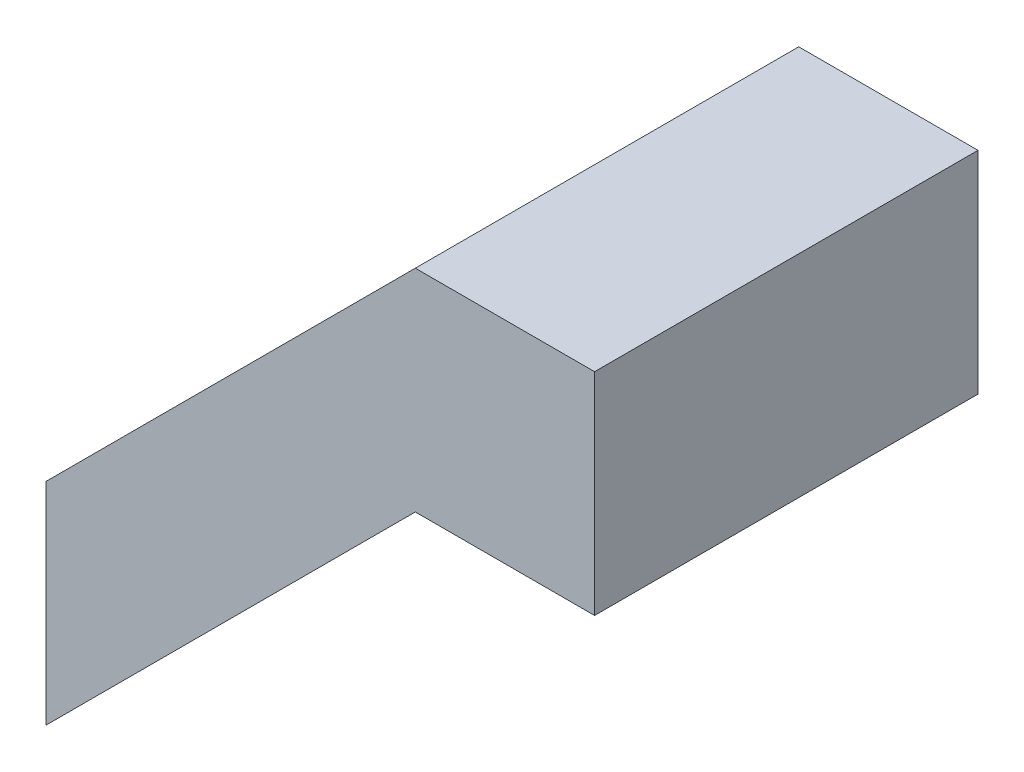
from build123d import *

# Parameters (mm, degrees)
SALIENTE_EXTRUIR1_DEPTH = 9.08
SALIENTE_EXTRUIR4_DEPTH = 1.5
SALIENTE_EXTRUIR5_DEPTH = 4.08


with BuildPart() as part:
    # Croquis1 → Saliente-Extruir1 (new body)
    with BuildSketch(Plane.XY):
        Polygon((126.24514053, -55.999935), (126.24514053, -50.999935), (121.99984, -50.999935), (113.25453947, -59.74523553), (113.25453947, -64.74523553), (115.25453947, -62.74523553), (115.25453947, -60.24523553), (119.25453947, -56.24523553), (119.25453947, -58.74523553), (121.99984, -55.999935), align=None)
    extrude(amount=-SALIENTE_EXTRUIR1_DEPTH)

    # Croquis4 → Saliente-Extruir4 (add)
    with BuildSketch(Plane.XY):
        Polygon((115.25453947, -60.24523553), (115.25453947, -62.74523553), (119.25453947, -58.74523553), (119.25453947, -56.24523553), align=None)
    extrude(amount=-SALIENTE_EXTRUIR4_DEPTH)

    # Croquis5 → Saliente-Extruir5 (add)
    with BuildSketch(Plane(origin=(0, 0, -9.08), x_dir=(-1, 0, 0), z_dir=(0, 0, -1))):
        Polygon((-115.25453947, -60.24523553), (-115.25453947, -62.74523553), (-119.25453947, -58.74523553), (-119.25453947, -56.24523553), align=None)
    extrude(amount=-SALIENTE_EXTRUIR5_DEPTH)


solid = part.part
